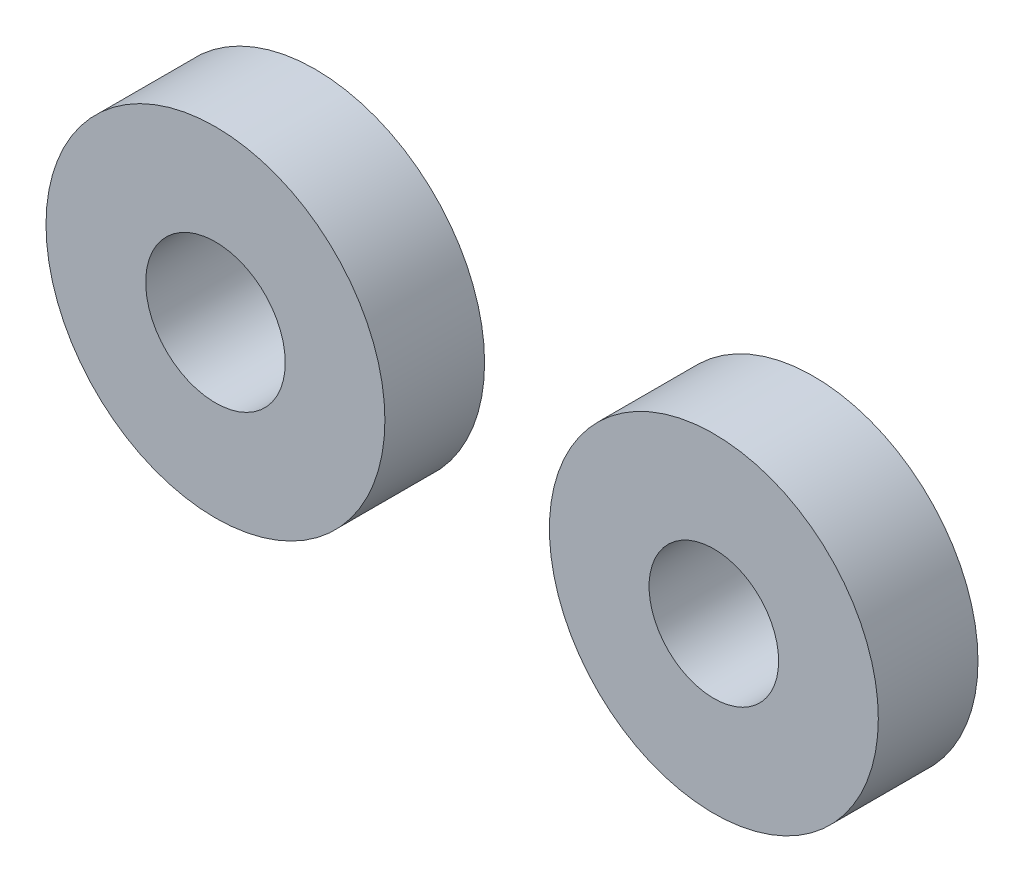
from build123d import *

# Parameters (mm, degrees)
SKETCH1_R             = 4.318
SKETCH1_R_2           = 1.778
BOSS_EXTRUDE1_DEPTH   = 2.54
SKETCH1_R_3           = 4.191
SKETCH1_R_4           = 1.651
BOSS_EXTRUDE1_2_DEPTH = 2.54


with BuildPart() as part:
    # Sketch1 → Boss-Extrude1 (new body)
    with BuildSketch(Plane.XY):
        Circle(SKETCH1_R)
        Circle(SKETCH1_R_2, mode=Mode.SUBTRACT)
    extrude(amount=BOSS_EXTRUDE1_DEPTH)


with BuildPart() as body_2:
    # Sketch1 → Boss-Extrude1 2 (new body)
    with BuildSketch(Plane.XY):
        with Locations((12.7, -0.298823529)):
            Circle(SKETCH1_R_3)
        with Locations((12.7, -0.298823529)):
            Circle(SKETCH1_R_4, mode=Mode.SUBTRACT)
    extrude(amount=BOSS_EXTRUDE1_2_DEPTH)


solid = Compound([part.part, body_2.part])
